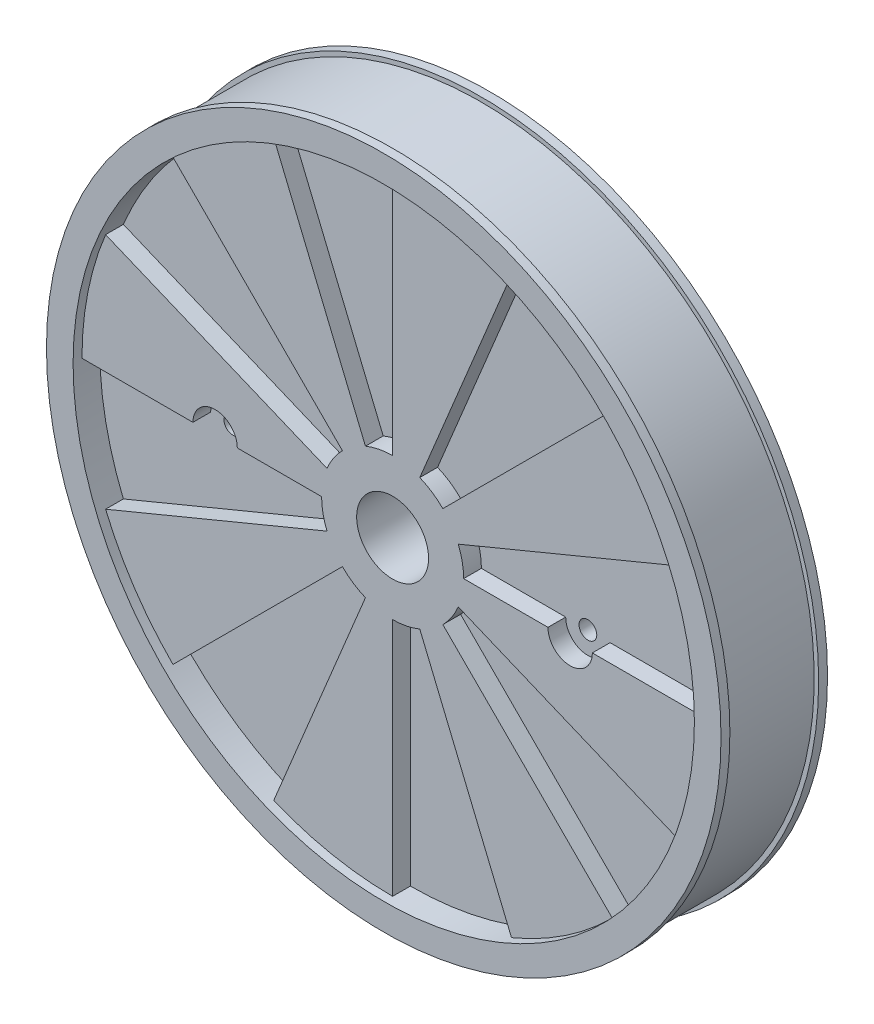
from build123d import *
from build123d.topology import SkipClean

# Parameters (mm, degrees)
CROQUIS1_R                 = 37.5
SALIENTE_EXTRUIR1_DEPTH    = 3.5
CROQUIS3_R                 = 38
SALIENTE_EXTRUIR2_DEPTH    = 1
SALIENTE_EXTRUIR4_START    = 1
CROQUIS5_R                 = 38
SALIENTE_EXTRUIR4_DEPTH    = 1
CROQUIS6_R                 = 4.05
CORTAR_EXTRUIR1_DEPTH      = 31
SALIENTE_EXTRUIR5_START    = 2
CROQUIS7_R                 = 8
CROQUIS7_R_2               = 4.05
SALIENTE_EXTRUIR5_DEPTH    = 2
SALIENTE_EXTRUIR7_START    = 2
SALIENTE_EXTRUIR7_DEPTH    = 2
SALIENTE_EXTRUIR8_START    = 3
CROQUIS10_R                = 38
CROQUIS10_R_2              = 35
SALIENTE_EXTRUIR8_DEPTH    = 3
CORTAR_EXTRUIR2_DEPTH      = 21
CORTAR_EXTRUIR2_DEPTH_BACK = 48
CROQUIS11_R                = 1
CROQUIS15_OUTSIDE_W        = 99.63
CROQUIS15_OUTSIDE_H        = 99.63
CROQUIS15_OUTSIDE_R        = 37.5
CORTAR_EXTRUIR6_DEPTH      = 10
CORTAR_EXTRUIR10_DEPTH     = 2


with BuildPart() as part:
    # Croquis1 → Saliente-Extruir1 (new, symmetric)
    with BuildSketch(Plane.XY):
        Circle(CROQUIS1_R)
    extrude(amount=SALIENTE_EXTRUIR1_DEPTH, both=True)

    # Croquis3 → Saliente-Extruir2 (add)
    with BuildSketch(Plane.XY.offset(3.5)):
        Circle(CROQUIS3_R)
    extrude(amount=SALIENTE_EXTRUIR2_DEPTH)

    # Croquis5 → Saliente-Extruir4 (add)
    with BuildSketch(Plane(origin=(0, 0, -3.5), x_dir=(-1, 0, 0), z_dir=(0, 0, -1)).offset(SALIENTE_EXTRUIR4_START)):
        with Locations(Location((0, 0, 0), (0, 0, 180))):
            Circle(CROQUIS5_R)
    extrude(amount=-SALIENTE_EXTRUIR4_DEPTH)

    # Croquis6 → Cortar-Extruir1 (cut)
    with BuildSketch(Plane.XY.offset(4.5)):
        Circle(CROQUIS6_R)
    extrude(amount=-CORTAR_EXTRUIR1_DEPTH, mode=Mode.SUBTRACT)

    # Croquis7 → Saliente-Extruir5 (add)
    with BuildSketch(Plane.XY.offset(4.5).offset(SALIENTE_EXTRUIR5_START)):
        Circle(CROQUIS7_R)
        Circle(CROQUIS7_R_2, mode=Mode.SUBTRACT)
    extrude(amount=-SALIENTE_EXTRUIR5_DEPTH)

    # Croquis9 → Saliente-Extruir7 (add)
    with BuildSketch(Plane.XY.offset(4.5).offset(SALIENTE_EXTRUIR7_START)):
        with BuildLine():
            Line((0, 35), (0, 8))
            ThreePointArc((0, 8), (1.560722576, 7.846282243), (3.061467459, 7.39103626))
            Line((3.061467459, 7.39103626), (13.393920133, 32.335783638))
            ThreePointArc((13.393920133, 32.335783638), (6.828161271, 34.327484814), (0, 35))
        make_face()
        with BuildLine():
            Line((-35, 0), (-8, 0))
            ThreePointArc((-8, 0), (-7.846282243, 1.560722576), (-7.39103626, 3.061467459))
            Line((-7.39103626, 3.061467459), (-32.335783638, 13.393920133))
            ThreePointArc((-32.335783638, 13.393920133), (-34.327484814, 6.828161271), (-35, 0))
        make_face()
        with BuildLine():
            Line((-24.748737342, 24.748737342), (-5.656854249, 5.656854249))
            ThreePointArc((-5.656854249, 5.656854249), (-4.444561864, 6.651756898), (-3.061467459, 7.39103626))
            Line((-3.061467459, 7.39103626), (-13.393920133, 32.335783638))
            ThreePointArc((-13.393920133, 32.335783638), (-19.444958156, 29.101436431), (-24.748737342, 24.748737342))
        make_face()
        with BuildLine():
            Line((24.748737342, 24.748737342), (5.656854249, 5.656854249))
            ThreePointArc((5.656854249, 5.656854249), (6.651756898, 4.444561864), (7.39103626, 3.061467459))
            Line((7.39103626, 3.061467459), (32.335783638, 13.393920133))
            ThreePointArc((32.335783638, 13.393920133), (29.101436431, 19.444958156), (24.748737342, 24.748737342))
        make_face()
        with BuildLine():
            Line((-5.656854249, -5.656854249), (-24.748737342, -24.748737342))
            ThreePointArc((-24.748737342, -24.748737342), (-29.101436431, -19.444958156), (-32.335783638, -13.393920133))
            Line((-32.335783638, -13.393920133), (-7.39103626, -3.061467459))
            ThreePointArc((-7.39103626, -3.061467459), (-6.651756898, -4.444561864), (-5.656854249, -5.656854249))
        make_face()
        with BuildLine():
            Line((8, 0), (35, 0))
            ThreePointArc((35, 0), (34.327484814, -6.828161271), (32.335783638, -13.393920133))
            Line((32.335783638, -13.393920133), (7.39103626, -3.061467459))
            ThreePointArc((7.39103626, -3.061467459), (7.846282243, -1.560722576), (8, 0))
        make_face()
        with BuildLine():
            Line((0, -8), (0, -35))
            ThreePointArc((0, -35), (-6.828161271, -34.327484814), (-13.393920133, -32.335783638))
            Line((-13.393920133, -32.335783638), (-3.061467459, -7.39103626))
            ThreePointArc((-3.061467459, -7.39103626), (-1.560722576, -7.846282243), (0, -8))
        make_face()
        with BuildLine():
            Line((3.061467459, -7.39103626), (13.393920133, -32.335783638))
            ThreePointArc((13.393920133, -32.335783638), (19.444958156, -29.101436431), (24.748737342, -24.748737342))
            Line((24.748737342, -24.748737342), (5.656854249, -5.656854249))
            ThreePointArc((5.656854249, -5.656854249), (4.444561864, -6.651756898), (3.061467459, -7.39103626))
        make_face()
    extrude(amount=-SALIENTE_EXTRUIR7_DEPTH)

    # Croquis10 → Saliente-Extruir8 (add)
    with BuildSketch(Plane.XY.offset(4.5).offset(SALIENTE_EXTRUIR8_START)):
        Circle(CROQUIS10_R)
        Circle(CROQUIS10_R_2, mode=Mode.SUBTRACT)
    extrude(amount=-SALIENTE_EXTRUIR8_DEPTH)

    # Croquis11 → Cortar-Extruir2 (cut, two sides: drawn at the far end of the back side and taken through both)
    with BuildSketch(Plane.XY.offset(6.5).offset(-CORTAR_EXTRUIR2_DEPTH_BACK)):
        with Locations(Location((-20, 0, 0), (0, 0, 180))):
            Circle(CROQUIS11_R)
        with Locations(Location((20, 0, 0), (0, 0, 180))):
            Circle(CROQUIS11_R)
    extrude(amount=CORTAR_EXTRUIR2_DEPTH + CORTAR_EXTRUIR2_DEPTH_BACK, mode=Mode.SUBTRACT)

    # Croquis15 outside → Cortar-Extruir6 (cut)
    with SkipClean():  # the faces are left unmerged after this step: merging them gives an invalid solid
        with BuildSketch(Plane.XY.offset(-3.5)):
            Rectangle(CROQUIS15_OUTSIDE_W, CROQUIS15_OUTSIDE_H)
            with Locations(Location((0, 0, 0), (0, 0, 180))):
                Circle(CROQUIS15_OUTSIDE_R, mode=Mode.SUBTRACT)
        extrude(amount=CORTAR_EXTRUIR6_DEPTH, mode=Mode.SUBTRACT)

    # Croquis17 → Cortar-Extruir10 (cut)
    with SkipClean():  # the faces are left unmerged after this step: merging them gives an invalid solid
        with BuildSketch(Plane.XY.offset(6.5)):
            with BuildLine():
                Line((22.5, 0), (21, 0))
                ThreePointArc((21, 0), (20, -1), (19, 0))
                Line((19, 0), (17.5, 0))
                ThreePointArc((17.5, 0), (20, -2.5), (22.5, 0))
            make_face()
            with BuildLine():
                Line((-21, 0), (-22.5, 0))
                ThreePointArc((-22.5, 0), (-20, 2.5), (-17.5, 0))
                Line((-17.5, 0), (-19, 0))
                ThreePointArc((-19, 0), (-20, 1), (-21, 0))
            make_face()
        extrude(amount=-CORTAR_EXTRUIR10_DEPTH, mode=Mode.SUBTRACT)


solid = part.part
